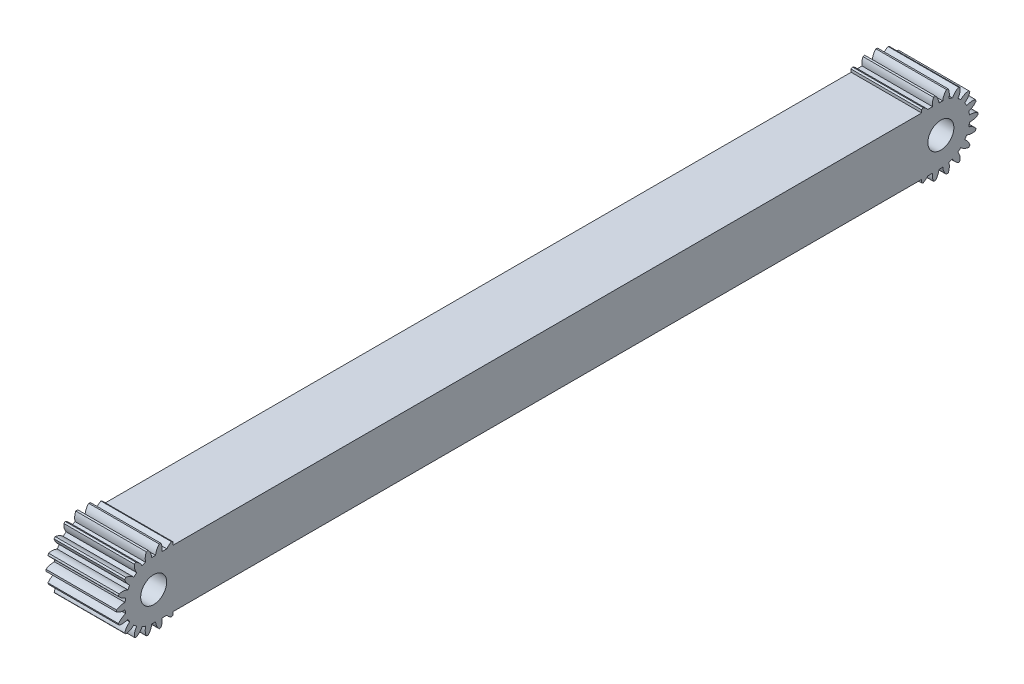
from build123d import *

# Parameters (mm, degrees)
SKETCH1_R           = 1.5
BOSS_EXTRUDE1_DEPTH = 9.5
SKETCH6_R           = 1.75
CUT_EXTRUDE1_DEPTH  = 10
BOSS_EXTRUDE2_START = -9.5
SKETCH7_R           = 1.75
BOSS_EXTRUDE2_DEPTH = 9.5
BOSS_EXTRUDE3_START = -9.5
SKETCH12_R          = 1.75
BOSS_EXTRUDE3_DEPTH = 9.5


with BuildPart() as part:
    # Sketch1 → Boss-Extrude1 (new body)
    with BuildSketch(Plane(origin=(7.237173519, 0, 0), x_dir=(0, 0, -1), z_dir=(1, 0, 0))):
        with BuildLine():
            ThreePointArc((-5.289048282, -2.350250733), (-5.026675272, -2.890921626), (-4.600943819, -3.315088269))
            ThreePointArc((-4.600943819, -3.315088269), (-4.735872829, -3.531952721), (-4.856218448, -3.757236898))
            ThreePointArc((-4.856218448, -3.757236898), (-5.436423263, -3.600625966), (-6.035844497, -3.643739721))
            ThreePointArc((-6.035844497, -3.643739721), (-6.079353519, -3.758852004), (-6.120016424, -3.87500019))
            ThreePointArc((-6.120016424, -3.87500019), (-5.688546106, -4.293327784), (-5.143415866, -4.546305316))
            ThreePointArc((-5.143415866, -4.546305316), (-5.19603565, -4.796239681), (-5.232071814, -5.049098185))
            ThreePointArc((-5.232071814, -5.049098185), (-5.83085009, -5.100373782), (-6.379376028, -5.345901595))
            ThreePointArc((-6.379376028, -5.345901595), (-6.380890415, -5.468952721), (-6.379376028, -5.592003847))
            ThreePointArc((-6.379376028, -5.592003847), (-5.83085009, -5.83753166), (-5.232071814, -5.888807257))
            ThreePointArc((-5.232071814, -5.888807257), (-5.19603565, -6.141665761), (-5.143415866, -6.391600126))
            ThreePointArc((-5.143415866, -6.391600126), (-5.688546106, -6.644577658), (-6.120016424, -7.062905252))
            ThreePointArc((-6.120016424, -7.062905252), (-6.079353519, -7.179053438), (-6.035844497, -7.294165721))
            ThreePointArc((-6.035844497, -7.294165721), (-5.436423263, -7.337279476), (-4.856218448, -7.180668544))
            ThreePointArc((-4.856218448, -7.180668544), (-4.735872829, -7.405952721), (-4.600943819, -7.622817173))
            ThreePointArc((-4.600943819, -7.622817173), (-5.026675272, -8.046983816), (-5.289048282, -8.587654709))
            ThreePointArc((-5.289048282, -8.587654709), (-5.211112631, -8.682890769), (-5.130856804, -8.776179971))
            ThreePointArc((-5.130856804, -8.776179971), (-4.552839321, -8.611679512), (-4.061189232, -8.266071641))
            ThreePointArc((-4.061189232, -8.266071641), (-3.871049615, -8.436608894), (-3.670085809, -8.594246379))
            ThreePointArc((-3.670085809, -8.594246379), (-3.925068977, -9.138441376), (-3.986698622, -9.736242679))
            ThreePointArc((-3.986698622, -9.736242679), (-3.880890415, -9.79907974), (-3.773567821, -9.859293805))
            ThreePointArc((-3.773567821, -9.859293805), (-3.286671528, -9.507020315), (-2.942876421, -9.014100915))
            ThreePointArc((-2.942876421, -9.014100915), (-2.70587645, -9.109321934), (-2.463117049, -9.188719046))
            ThreePointArc((-2.463117049, -9.188719046), (-2.5165972, -9.787304449), (-2.370050035, -10.370132502))
            ThreePointArc((-2.370050035, -10.370132502), (-2.249131303, -10.392991486), (-2.12768663, -10.412867709))
            ThreePointArc((-2.12768663, -10.412867709), (-1.790638407, -9.915310571), (-1.636165045, -9.334532996))
            ThreePointArc((-1.636165045, -9.334532996), (-1.380890415, -9.342952721), (-1.125615785, -9.334532996))
            ThreePointArc((-1.125615785, -9.334532996), (-0.971142423, -9.915310571), (-0.6340942, -10.412867709))
            ThreePointArc((-0.6340942, -10.412867709), (-0.512649527, -10.392991486), (-0.391730795, -10.370132502))
            ThreePointArc((-0.391730795, -10.370132502), (-0.24518363, -9.787304449), (-0.298663781, -9.188719046))
            ThreePointArc((-0.298663781, -9.188719046), (-0.05590438, -9.109321934), (0.181095591, -9.014100915))
            ThreePointArc((0.181095591, -9.014100915), (0.524890698, -9.507020315), (1.011786991, -9.859293805))
            ThreePointArc((1.011786991, -9.859293805), (1.119109585, -9.79907974), (1.224917792, -9.736242679))
            ThreePointArc((1.224917792, -9.736242679), (1.163288147, -9.138441376), (0.908304979, -8.594246379))
            ThreePointArc((0.908304979, -8.594246379), (1.109268785, -8.436608894), (1.299408402, -8.266071641))
            ThreePointArc((1.299408402, -8.266071641), (1.791058491, -8.611679512), (2.369075974, -8.776179971))
            ThreePointArc((2.369075974, -8.776179971), (2.449331801, -8.682890769), (2.527267452, -8.587654709))
            ThreePointArc((2.527267452, -8.587654709), (2.264894442, -8.046983816), (1.839162989, -7.622817173))
            ThreePointArc((1.839162989, -7.622817173), (1.974091999, -7.405952721), (2.094437618, -7.180668544))
            ThreePointArc((2.094437618, -7.180668544), (2.674642433, -7.337279476), (3.274063667, -7.294165721))
            ThreePointArc((3.274063667, -7.294165721), (3.317572689, -7.179053438), (3.358235594, -7.062905252))
            ThreePointArc((3.358235594, -7.062905252), (2.926765276, -6.644577658), (2.381635036, -6.391600126))
            ThreePointArc((2.381635036, -6.391600126), (2.43425482, -6.141665761), (2.470290984, -5.888807257))
            ThreePointArc((2.470290984, -5.888807257), (3.06906926, -5.83753166), (3.617595198, -5.592003847))
            ThreePointArc((3.617595198, -5.592003847), (3.619109585, -5.468952721), (3.617595198, -5.345901595))
            ThreePointArc((3.617595198, -5.345901595), (3.06906926, -5.100373782), (2.470290984, -5.049098185))
            ThreePointArc((2.470290984, -5.049098185), (2.43425482, -4.796239681), (2.381635036, -4.546305316))
            ThreePointArc((2.381635036, -4.546305316), (2.926765276, -4.293327784), (3.358235594, -3.87500019))
            ThreePointArc((3.358235594, -3.87500019), (3.317572689, -3.758852004), (3.274063667, -3.643739721))
            ThreePointArc((3.274063667, -3.643739721), (2.674642433, -3.600625966), (2.094437618, -3.757236898))
            ThreePointArc((2.094437618, -3.757236898), (1.974091999, -3.531952721), (1.839162989, -3.315088269))
            ThreePointArc((1.839162989, -3.315088269), (2.264894442, -2.890921626), (2.527267452, -2.350250733))
            ThreePointArc((2.527267452, -2.350250733), (2.449331801, -2.255014673), (2.369075974, -2.161725471))
            ThreePointArc((2.369075974, -2.161725471), (1.791058491, -2.32622593), (1.299408402, -2.671833801))
            ThreePointArc((1.299408402, -2.671833801), (1.109268785, -2.501296548), (0.908304979, -2.343659063))
            ThreePointArc((0.908304979, -2.343659063), (1.163288147, -1.799464066), (1.224917792, -1.201662763))
            ThreePointArc((1.224917792, -1.201662763), (1.119109585, -1.138825702), (1.011786991, -1.078611637))
            ThreePointArc((1.011786991, -1.078611637), (0.524890698, -1.430885127), (0.181095591, -1.923804527))
            ThreePointArc((0.181095591, -1.923804527), (-0.05590438, -1.828583508), (-0.298663781, -1.749186396))
            ThreePointArc((-0.298663781, -1.749186396), (-0.24518363, -1.150600993), (-0.391730795, -0.56777294))
            ThreePointArc((-0.391730795, -0.56777294), (-0.512649527, -0.544913956), (-0.6340942, -0.525037733))
            ThreePointArc((-0.6340942, -0.525037733), (-0.971142423, -1.022594871), (-1.125615785, -1.603372446))
            ThreePointArc((-1.125615785, -1.603372446), (-1.380890415, -1.594952721), (-1.636165045, -1.603372446))
            ThreePointArc((-1.636165045, -1.603372446), (-1.790638407, -1.022594871), (-2.12768663, -0.525037733))
            ThreePointArc((-2.12768663, -0.525037733), (-2.249131303, -0.544913956), (-2.370050035, -0.56777294))
            ThreePointArc((-2.370050035, -0.56777294), (-2.5165972, -1.150600993), (-2.463117049, -1.749186396))
            ThreePointArc((-2.463117049, -1.749186396), (-2.70587645, -1.828583508), (-2.942876421, -1.923804527))
            ThreePointArc((-2.942876421, -1.923804527), (-3.286671528, -1.430885127), (-3.773567821, -1.078611637))
            ThreePointArc((-3.773567821, -1.078611637), (-3.880890415, -1.138825702), (-3.986698622, -1.201662763))
            ThreePointArc((-3.986698622, -1.201662763), (-3.925068977, -1.799464066), (-3.670085809, -2.343659063))
            ThreePointArc((-3.670085809, -2.343659063), (-3.871049615, -2.501296548), (-4.061189232, -2.671833801))
            ThreePointArc((-4.061189232, -2.671833801), (-4.552839321, -2.32622593), (-5.130856804, -2.161725471))
            ThreePointArc((-5.130856804, -2.161725471), (-5.211112631, -2.255014673), (-5.289048282, -2.350250733))
        make_face()
        with Locations(Location((-1.380890415, -5.468952721, 0), (0, 0, 180))):
            Circle(SKETCH1_R, mode=Mode.SUBTRACT)
    extrude(amount=-BOSS_EXTRUDE1_DEPTH)

    # Sketch6 → Cut-Extrude1 (cut)
    with BuildSketch(Plane(origin=(7.237173519, 0, 0), x_dir=(0, 0, -1), z_dir=(1, 0, 0))):
        with Locations((-1.380890415, -5.468952721)):
            Circle(SKETCH6_R)
    extrude(amount=-CUT_EXTRUDE1_DEPTH, mode=Mode.SUBTRACT)

    # Sketch7 → Boss-Extrude2 (add)
    with BuildSketch(Plane.ZY.offset(2.262826481).offset(BOSS_EXTRUDE2_START)):
        with BuildLine():
            Line((-104.619109585, -1.594952721), (1.380890415, -1.594952721))
            ThreePointArc((1.380890415, -1.594952721), (5.254890415, -5.468952721), (1.380890415, -9.342952721))
            Line((1.380890415, -9.342952721), (-104.619109585, -9.342952721))
            ThreePointArc((-104.619109585, -9.342952721), (-108.493109585, -5.468952721), (-104.619109585, -1.594952721))
        make_face()
        with Locations((-104.619109585, -5.468952721)):
            Circle(SKETCH7_R, mode=Mode.SUBTRACT)
        with Locations(Location((1.380890415, -5.468952721, 0), (0, 0, 180))):
            Circle(SKETCH7_R, mode=Mode.SUBTRACT)
    extrude(amount=BOSS_EXTRUDE2_DEPTH)

    # Sketch12 → Boss-Extrude3 (add)
    with BuildSketch(Plane.ZY.offset(2.262826481).offset(BOSS_EXTRUDE3_START)):
        with BuildLine():
            ThreePointArc((-101.399056181, -3.315088269), (-100.973324728, -2.890921626), (-100.710951718, -2.350250733))
            ThreePointArc((-100.710951718, -2.350250733), (-100.788887369, -2.255014673), (-100.869143196, -2.161725471))
            ThreePointArc((-100.869143196, -2.161725471), (-101.447160679, -2.32622593), (-101.938810768, -2.671833801))
            ThreePointArc((-101.938810768, -2.671833801), (-102.128950385, -2.501296548), (-102.329914191, -2.343659063))
            ThreePointArc((-102.329914191, -2.343659063), (-102.074931023, -1.799464066), (-102.013301378, -1.201662763))
            ThreePointArc((-102.013301378, -1.201662763), (-102.119109585, -1.138825702), (-102.226432179, -1.078611637))
            ThreePointArc((-102.226432179, -1.078611637), (-102.713328472, -1.430885127), (-103.057123579, -1.923804527))
            ThreePointArc((-103.057123579, -1.923804527), (-103.29412355, -1.828583508), (-103.536882951, -1.749186396))
            ThreePointArc((-103.536882951, -1.749186396), (-103.4834028, -1.150600993), (-103.629949965, -0.56777294))
            ThreePointArc((-103.629949965, -0.56777294), (-103.750868697, -0.544913956), (-103.87231337, -0.525037733))
            ThreePointArc((-103.87231337, -0.525037733), (-104.209361593, -1.022594871), (-104.363834955, -1.603372446))
            ThreePointArc((-104.363834955, -1.603372446), (-104.619109585, -1.594952721), (-104.874384215, -1.603372446))
            ThreePointArc((-104.874384215, -1.603372446), (-105.028857577, -1.022594871), (-105.3659058, -0.525037733))
            ThreePointArc((-105.3659058, -0.525037733), (-105.487350473, -0.544913956), (-105.608269205, -0.56777294))
            ThreePointArc((-105.608269205, -0.56777294), (-105.75481637, -1.150600993), (-105.701336219, -1.749186396))
            ThreePointArc((-105.701336219, -1.749186396), (-105.94409562, -1.828583508), (-106.181095591, -1.923804527))
            ThreePointArc((-106.181095591, -1.923804527), (-106.524890698, -1.430885127), (-107.011786991, -1.078611637))
            ThreePointArc((-107.011786991, -1.078611637), (-107.119109585, -1.138825702), (-107.224917792, -1.201662763))
            ThreePointArc((-107.224917792, -1.201662763), (-107.163288147, -1.799464066), (-106.908304979, -2.343659063))
            ThreePointArc((-106.908304979, -2.343659063), (-107.109268785, -2.501296548), (-107.299408402, -2.671833801))
            ThreePointArc((-107.299408402, -2.671833801), (-107.791058491, -2.32622593), (-108.369075974, -2.161725471))
            ThreePointArc((-108.369075974, -2.161725471), (-108.449331801, -2.255014673), (-108.527267452, -2.350250733))
            ThreePointArc((-108.527267452, -2.350250733), (-108.264894442, -2.890921626), (-107.839162989, -3.315088269))
            ThreePointArc((-107.839162989, -3.315088269), (-107.974091999, -3.531952721), (-108.094437618, -3.757236898))
            ThreePointArc((-108.094437618, -3.757236898), (-108.674642433, -3.600625966), (-109.274063667, -3.643739721))
            ThreePointArc((-109.274063667, -3.643739721), (-109.317572689, -3.758852004), (-109.358235594, -3.87500019))
            ThreePointArc((-109.358235594, -3.87500019), (-108.926765276, -4.293327784), (-108.381635036, -4.546305316))
            ThreePointArc((-108.381635036, -4.546305316), (-108.43425482, -4.796239681), (-108.470290984, -5.049098185))
            ThreePointArc((-108.470290984, -5.049098185), (-109.06906926, -5.100373782), (-109.617595198, -5.345901595))
            ThreePointArc((-109.617595198, -5.345901595), (-109.619109585, -5.468952721), (-109.617595198, -5.592003847))
            ThreePointArc((-109.617595198, -5.592003847), (-109.06906926, -5.83753166), (-108.470290984, -5.888807257))
            ThreePointArc((-108.470290984, -5.888807257), (-108.43425482, -6.141665761), (-108.381635036, -6.391600126))
            ThreePointArc((-108.381635036, -6.391600126), (-108.926765276, -6.644577658), (-109.358235594, -7.062905252))
            ThreePointArc((-109.358235594, -7.062905252), (-109.317572689, -7.179053438), (-109.274063667, -7.294165721))
            ThreePointArc((-109.274063667, -7.294165721), (-108.674642433, -7.337279476), (-108.094437618, -7.180668544))
            ThreePointArc((-108.094437618, -7.180668544), (-107.974091999, -7.405952721), (-107.839162989, -7.622817173))
            ThreePointArc((-107.839162989, -7.622817173), (-108.264894442, -8.046983816), (-108.527267452, -8.587654709))
            ThreePointArc((-108.527267452, -8.587654709), (-108.449331801, -8.682890769), (-108.369075974, -8.776179971))
            ThreePointArc((-108.369075974, -8.776179971), (-107.791058491, -8.611679512), (-107.299408402, -8.266071641))
            ThreePointArc((-107.299408402, -8.266071641), (-107.109268785, -8.436608894), (-106.908304979, -8.594246379))
            ThreePointArc((-106.908304979, -8.594246379), (-107.163288147, -9.138441376), (-107.224917792, -9.736242679))
            ThreePointArc((-107.224917792, -9.736242679), (-107.119109585, -9.79907974), (-107.011786991, -9.859293805))
            ThreePointArc((-107.011786991, -9.859293805), (-106.524890698, -9.507020315), (-106.181095591, -9.014100915))
            ThreePointArc((-106.181095591, -9.014100915), (-105.94409562, -9.109321934), (-105.701336219, -9.188719046))
            ThreePointArc((-105.701336219, -9.188719046), (-105.75481637, -9.787304449), (-105.608269205, -10.370132502))
            ThreePointArc((-105.608269205, -10.370132502), (-105.487350473, -10.392991486), (-105.3659058, -10.412867709))
            ThreePointArc((-105.3659058, -10.412867709), (-105.028857577, -9.915310571), (-104.874384215, -9.334532996))
            ThreePointArc((-104.874384215, -9.334532996), (-104.619109585, -9.342952721), (-104.363834955, -9.334532996))
            ThreePointArc((-104.363834955, -9.334532996), (-104.209361593, -9.915310571), (-103.87231337, -10.412867709))
            ThreePointArc((-103.87231337, -10.412867709), (-103.750868697, -10.392991486), (-103.629949965, -10.370132502))
            ThreePointArc((-103.629949965, -10.370132502), (-103.4834028, -9.787304449), (-103.536882951, -9.188719046))
            ThreePointArc((-103.536882951, -9.188719046), (-103.29412355, -9.109321934), (-103.057123579, -9.014100915))
            ThreePointArc((-103.057123579, -9.014100915), (-102.713328472, -9.507020315), (-102.226432179, -9.859293805))
            ThreePointArc((-102.226432179, -9.859293805), (-102.119109585, -9.79907974), (-102.013301378, -9.736242679))
            ThreePointArc((-102.013301378, -9.736242679), (-102.074931023, -9.138441376), (-102.329914191, -8.594246379))
            ThreePointArc((-102.329914191, -8.594246379), (-102.128950385, -8.436608894), (-101.938810768, -8.266071641))
            ThreePointArc((-101.938810768, -8.266071641), (-101.447160679, -8.611679512), (-100.869143196, -8.776179971))
            ThreePointArc((-100.869143196, -8.776179971), (-100.788887369, -8.682890769), (-100.710951718, -8.587654709))
            ThreePointArc((-100.710951718, -8.587654709), (-100.973324728, -8.046983816), (-101.399056181, -7.622817173))
            ThreePointArc((-101.399056181, -7.622817173), (-101.264127171, -7.405952721), (-101.143781552, -7.180668544))
            ThreePointArc((-101.143781552, -7.180668544), (-100.563576737, -7.337279476), (-99.964155503, -7.294165721))
            ThreePointArc((-99.964155503, -7.294165721), (-99.920646481, -7.179053438), (-99.879983576, -7.062905252))
            ThreePointArc((-99.879983576, -7.062905252), (-100.311453894, -6.644577658), (-100.856584134, -6.391600126))
            ThreePointArc((-100.856584134, -6.391600126), (-100.80396435, -6.141665761), (-100.767928186, -5.888807257))
            ThreePointArc((-100.767928186, -5.888807257), (-100.16914991, -5.83753166), (-99.620623972, -5.592003847))
            ThreePointArc((-99.620623972, -5.592003847), (-99.619109585, -5.468952721), (-99.620623972, -5.345901595))
            ThreePointArc((-99.620623972, -5.345901595), (-100.16914991, -5.100373782), (-100.767928186, -5.049098185))
            ThreePointArc((-100.767928186, -5.049098185), (-100.80396435, -4.796239681), (-100.856584134, -4.546305316))
            ThreePointArc((-100.856584134, -4.546305316), (-100.311453894, -4.293327784), (-99.879983576, -3.87500019))
            ThreePointArc((-99.879983576, -3.87500019), (-99.920646481, -3.758852004), (-99.964155503, -3.643739721))
            ThreePointArc((-99.964155503, -3.643739721), (-100.563576737, -3.600625966), (-101.143781552, -3.757236898))
            ThreePointArc((-101.143781552, -3.757236898), (-101.264127171, -3.531952721), (-101.399056181, -3.315088269))
        make_face()
        with Locations((-104.619109585, -5.468952721)):
            Circle(SKETCH12_R, mode=Mode.SUBTRACT)
    extrude(amount=BOSS_EXTRUDE3_DEPTH)


solid = part.part
